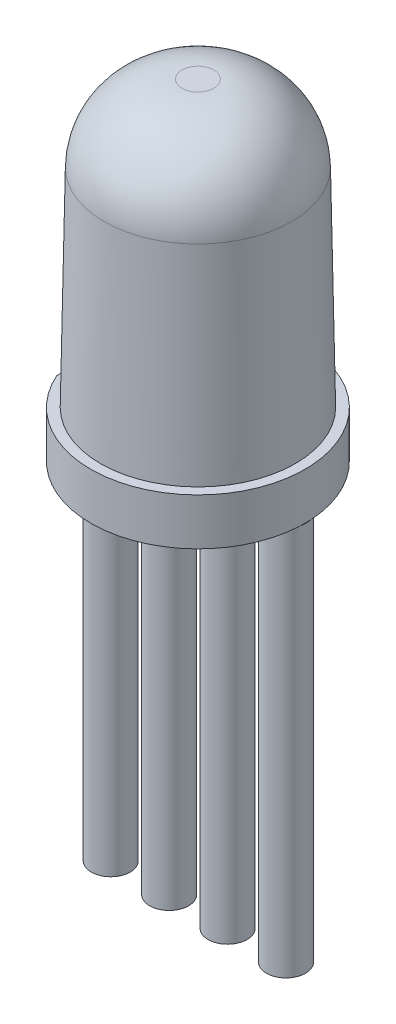
from build123d import *

# Parameters (mm, degrees)
SKETCH1_R             = 2.75
BOSS_EXTRUDE1_DEPTH   = 1.2
SKETCH2_R             = 2.5
BOSS_EXTRUDE2_DEPTH   = 7.3
BOSS_EXTRUDE2_TAPER   = 1
FILLET1_R             = 2
SKETCH3_W             = 2.968485726
SKETCH3_H             = 11.9471494
CUT_EXTRUDE1_DEPTH    = 7.3
SKETCH4_R             = 0.5
BOSS_EXTRUDE3_DEPTH   = 10
BOSS_EXTRUDE3_2_DEPTH = 10
BOSS_EXTRUDE3_3_DEPTH = 10
BOSS_EXTRUDE3_4_DEPTH = 10


with BuildPart() as part:
    # Sketch1 → Boss-Extrude1 (new body)
    with BuildSketch(Plane(origin=(0, 0, 0), x_dir=(1, 0, 0), z_dir=(0, 1, 0))):
        with Locations(Location((0, 0, 0), (0, 0, 270))):
            Circle(SKETCH1_R)
    extrude(amount=BOSS_EXTRUDE1_DEPTH)

    # Sketch2 → Boss-Extrude2 (add)
    with BuildSketch(Plane(origin=(0, 1.2, 0), x_dir=(1, 0, 0), z_dir=(0, 1, 0))):
        Circle(SKETCH2_R)
    extrude(amount=BOSS_EXTRUDE2_DEPTH, taper=BOSS_EXTRUDE2_TAPER)

    # Fillet1
    fillet1_edges = [part.edges().sort_by_distance(p)[0] for p in [
        (-2.372578026, 8.5, 0),
    ]]
    fillet(fillet1_edges, radius=FILLET1_R)

    # Sketch3 → Cut-Extrude1 (cut)
    with BuildSketch(Plane(origin=(0, 1.2, 0), x_dir=(1, 0, 0), z_dir=(0, 1, 0))):
        with Locations((-4.002574988, 2.203199908)):
            Rectangle(SKETCH3_W, SKETCH3_H)
    extrude(amount=-CUT_EXTRUDE1_DEPTH, mode=Mode.SUBTRACT)


with BuildPart() as body_2:
    # Sketch4 → Boss-Extrude3 (new body)
    with BuildSketch(Plane.XZ):
        with Locations(Location((-2.238079198, 0, 0), (0, 0, 270))):
            Circle(SKETCH4_R)
    extrude(amount=BOSS_EXTRUDE3_DEPTH)


with BuildPart() as body_3:
    # Sketch4 → Boss-Extrude3 2 (new body)
    with BuildSketch(Plane.XZ):
        with Locations(Location((-0.738079198, 0, 0), (0, 0, 270))):
            Circle(SKETCH4_R)
    extrude(amount=BOSS_EXTRUDE3_2_DEPTH)


with BuildPart() as body_4:
    # Sketch4 → Boss-Extrude3 3 (new body)
    with BuildSketch(Plane.XZ):
        with Locations(Location((0.761920802, 0, 0), (0, 0, 270))):
            Circle(SKETCH4_R)
    extrude(amount=BOSS_EXTRUDE3_3_DEPTH)


with BuildPart() as body_5:
    # Sketch4 → Boss-Extrude3 4 (new body)
    with BuildSketch(Plane.XZ):
        with Locations(Location((2.261920802, 0, 0), (0, 0, 270))):
            Circle(SKETCH4_R)
    extrude(amount=BOSS_EXTRUDE3_4_DEPTH)


solid = Compound([part.part, body_2.part, body_3.part, body_4.part, body_5.part])
